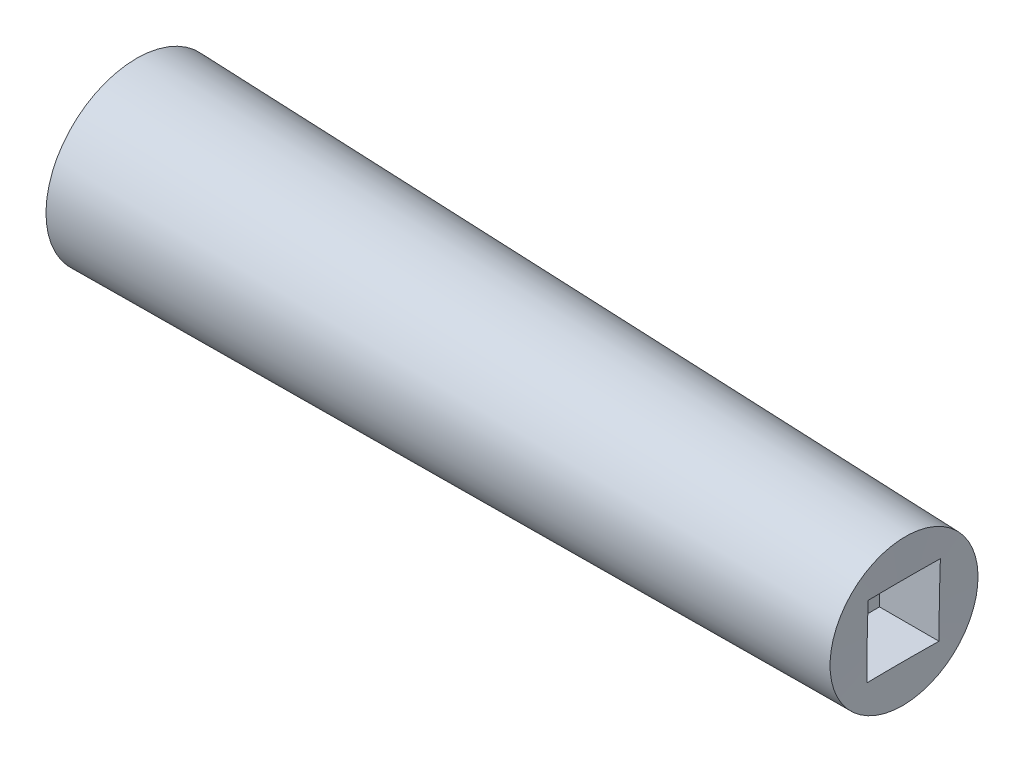
from build123d import *

# Parameters (mm, degrees)
SKETCH2_W          = 15.494
SKETCH2_H          = 15.494
CUT_EXTRUDE1_DEPTH = 12.7


with BuildPart() as part:
    # Sketch1 → Revolve1 (revolve)
    with BuildSketch(Plane.XY, mode=Mode.PRIVATE) as revolve1_sk:
        Polygon((165.1, 0), (165.1, 15.875), (0, 19.05), (0, 0), (12.7, 0), align=None)
    revolve(revolve1_sk.sketch.rotate(Axis((0, 19.05, 0), (0.9998151400298467, -0.01922721423134321, 0)), 180), axis=Axis((0, 19.05, 0), (0.9998151400298467, -0.01922721423134321, 0)))

    # Sketch2 → Cut-Extrude1 (cut, symmetric)
    with BuildSketch(Plane(origin=(165.1, 0, 0), x_dir=(0, 0, -1), z_dir=(1, 0, 0))):
        with Locations((0, 15.875)):
            Rectangle(SKETCH2_W, SKETCH2_H)
    extrude(amount=CUT_EXTRUDE1_DEPTH, both=True, mode=Mode.SUBTRACT)


solid = part.part
